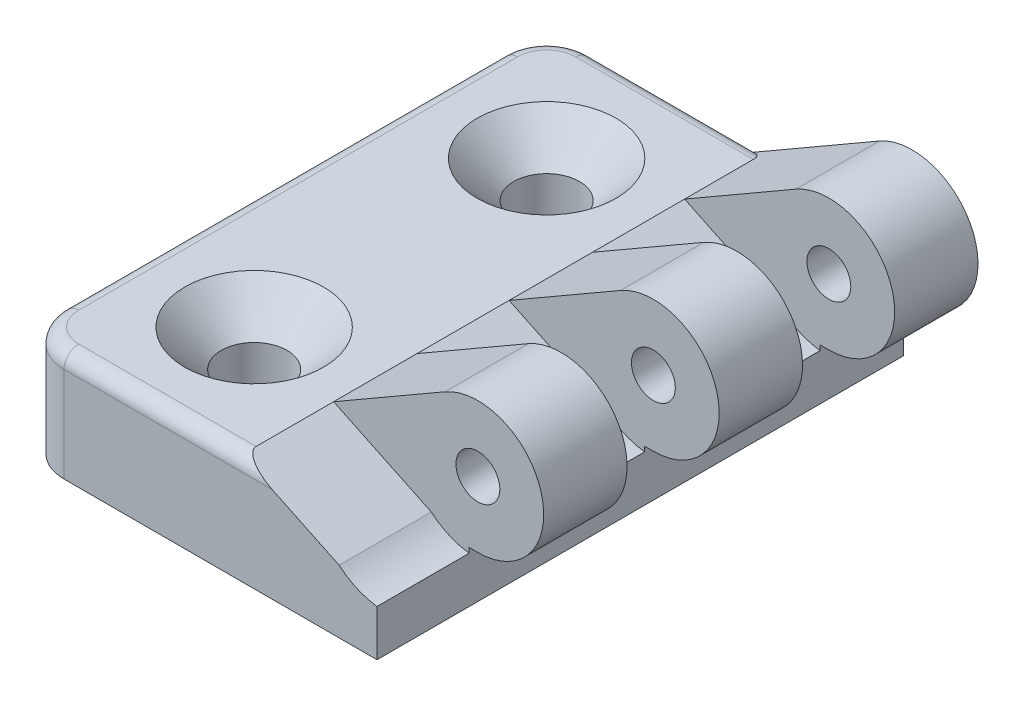
from build123d import *

# Parameters (mm, degrees)
CROQUIS1_R              = 1.5
SALIENTE_EXTRUIR1_DEPTH = 36
CORTAR_EXTRUIR1_DEPTH   = 6.3
MATRIZL1_COUNT          = 3
MATRIZL1_PITCH          = 12
CROQUIS3_R              = 2.25
CORTAR_EXTRUIR2_DEPTH   = 42.623310777
CHAFL_N1_SIZE           = 2.5
REDONDEO1_R             = 3
REDONDEO2_R             = 1


with BuildPart() as part:
    # Croquis1 → Saliente-Extruir1 (new body)
    with BuildSketch(Plane.XY):
        with BuildLine():
            Line((12.75, 7.897114317), (5.133974596, 3.5))
            Line((5.133974596, 3.5), (-10, 3.5))
            Line((-10, 3.5), (-10, -4))
            Line((-10, -4), (14.4, -4))
            Line((14.4, -4), (14.4, -0.5))
            Line((14.4, -0.5), (15, -0.5))
            ThreePointArc((15, -0.5), (19.346666218, 5.164685703), (12.75, 7.897114317))
        make_face()
        with Locations((15, 4)):
            Circle(CROQUIS1_R, mode=Mode.SUBTRACT)
    extrude(amount=-SALIENTE_EXTRUIR1_DEPTH)

    # Croquis2 → Cortar-Extruir1 (cut)
    with BuildSketch(Plane.XY):
        with BuildLine():
            Line((14.4, -0.842600764), (15, -0.5))
            ThreePointArc((15, -0.5), (19.346666218, 5.164685703), (12.75, 7.897114317))
            Line((12.75, 7.897114317), (5.133974596, 3.5))
            Line((5.133974596, 3.5), (11.80761005, 0.309549003))
            ThreePointArc((11.80761005, 0.309549003), (13.018228657, -0.459076642), (14.4, -0.842600764))
        make_face()
    cortar_extruir1 = extrude(amount=-CORTAR_EXTRUIR1_DEPTH, mode=Mode.SUBTRACT)

    # MatrizL1: Cortar-Extruir1 ×3
    with Locations(*[(0, 0, -i * MATRIZL1_PITCH) for i in range(1, MATRIZL1_COUNT)]):
        add(cortar_extruir1, mode=Mode.SUBTRACT)

    # Croquis3 → Cortar-Extruir2 (cut, through all)
    with BuildSketch(Plane(origin=(0, 3.5, 0), x_dir=(1, 0, 0), z_dir=(0, 1, 0))):
        with Locations(Location((-2, 28, 0), (0, 0, 270))):
            Circle(CROQUIS3_R)
        with Locations(Location((-2, 8, 0), (0, 0, 270))):
            Circle(CROQUIS3_R)
    extrude(amount=-CORTAR_EXTRUIR2_DEPTH, mode=Mode.SUBTRACT)

    # Chaflán1
    chafl_n1_edges = [part.edges().sort_by_distance(p)[0] for p in [
        (-2, 3.5, -30.25),
        (-2, 3.5, -10.25),
    ]]
    chamfer(chafl_n1_edges, length=CHAFL_N1_SIZE)

    # Redondeo1
    redondeo1_edges = [part.edges().sort_by_distance(p)[0] for p in [
        (-10, -0.25, -36),
        (-10, -0.25, 0),
    ]]
    fillet(redondeo1_edges, radius=REDONDEO1_R)

    # Redondeo2
    redondeo2_edges = [part.edges().sort_by_distance(p)[0] for p in [
        (-10, 3.5, -18),
        (-9.121320344, 3.5, -0.878679656),
        (-9.121320344, 3.5, -35.121320344),
        (-0.933012702, 3.5, -36),
        (-0.933012702, 3.5, 0),
    ]]
    fillet(redondeo2_edges, radius=REDONDEO2_R)


solid = part.part
